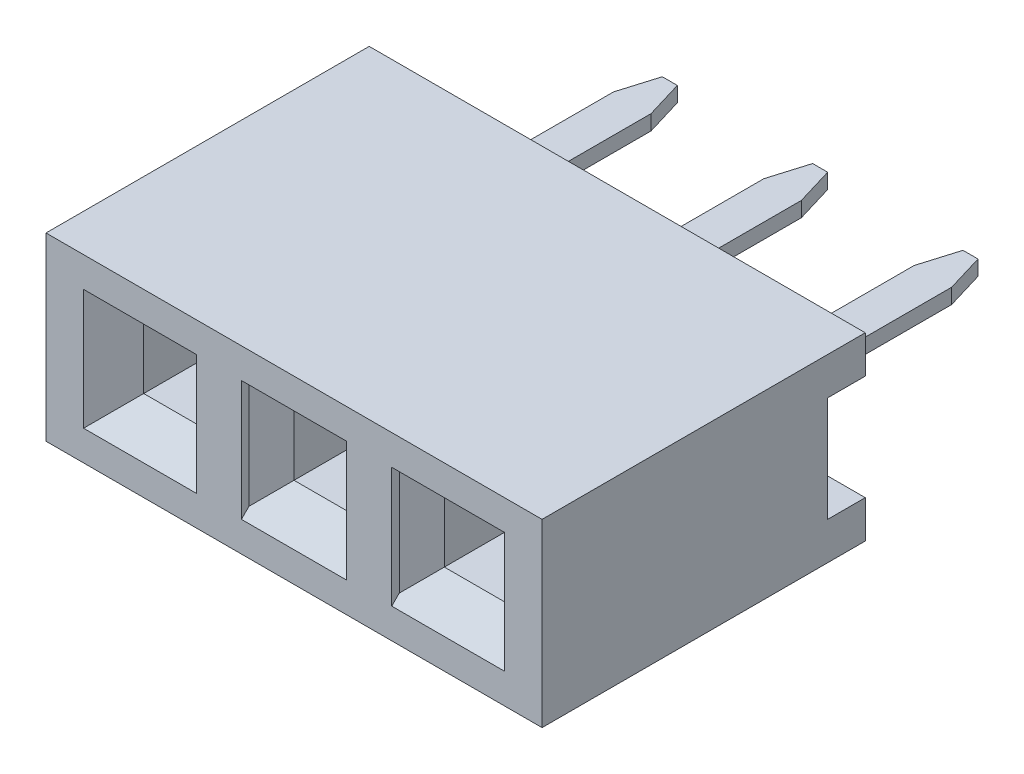
from build123d import *

# Parameters (mm, degrees)
SKETCH1_W           = 2.4
SKETCH1_H           = 4.3
BOSS_EXTRUDE1_DEPTH = 1.3
SKETCH_1_W          = 0.5
SKETCH_1_H          = 1.4
CUT_EXTRUDE_1_DEPTH = 6.166236541
SKETCH2_W           = 0.8
SKETCH2_H           = 0.8
CUT_EXTRUDE1_DEPTH  = 3.1
CHAMFER_1_SIZE      = 0.4
BOSS_EXTRUDE2_DEPTH = 0.1
LPATTERN1_COUNT     = 3
LPATTERN1_PITCH     = 2


with BuildPart() as part:
    # Sketch1 → Boss-Extrude1 (new, symmetric)
    with BuildSketch(Plane(origin=(0, 0, 0), x_dir=(0, -1, 0), z_dir=(1, 0, 0))):
        with Locations((0, -2.15)):
            Rectangle(SKETCH1_W, SKETCH1_H)
    extrude(amount=BOSS_EXTRUDE1_DEPTH, both=True)

    # Эскиз1 → Вырез-Вытянуть1 (cut, through all)
    with BuildSketch(Plane(origin=(1.3, 0, 0), x_dir=(0, 0, -1), z_dir=(1, 0, 0))):
        with Locations((-0.25, 0)):
            Rectangle(SKETCH_1_W, SKETCH_1_H)
    extrude(amount=-CUT_EXTRUDE_1_DEPTH, mode=Mode.SUBTRACT)

    # Sketch2 → Cut-Extrude1 (cut)
    with BuildSketch(Plane(origin=(0, 0, 4.3), x_dir=(-1, 0, 0), z_dir=(0, 0, 1))):
        Rectangle(SKETCH2_W, SKETCH2_H)
    extrude(amount=-CUT_EXTRUDE1_DEPTH, mode=Mode.SUBTRACT)

    # Фаска1
    chamfer_1_edges = [part.edges().sort_by_distance(p)[0] for p in [
        (-0.4, 0, 4.3),
        (0, -0.4, 4.3),
        (0.4, 0, 4.3),
        (0, 0.4, 4.3),
    ]]
    chamfer(chamfer_1_edges, length=CHAMFER_1_SIZE)

    # Sketch3 → Boss-Extrude2 (add, symmetric)
    with BuildSketch(Plane(origin=(0, 0, 0), x_dir=(1, 0, 0), z_dir=(0, 1, 0))):
        Polygon((-0.25, 0), (-0.25, 2.2), (-0.1, 2.7), (0.1, 2.7), (0.25, 2.2), (0.25, 0), (0.25, -0.5), (-0.25, -0.5), align=None)
        Polygon((0.4, -1.2), (-0.4, -1.2), (-0.4, -3.1), (-0.3, -3.1), (-0.3, -1.3), (0.3, -1.3), (0.3, -3.1), (0.4, -3.1), align=None)
    extrude(amount=BOSS_EXTRUDE2_DEPTH, both=True)


with BuildPart() as lpattern1_1:
    # LPattern1: pattern copy
    add(part.part.moved(Location(Vector(1, 0, 0) * (1 * LPATTERN1_PITCH))))


with BuildPart() as lpattern1_2:
    # LPattern1: pattern copy
    add(part.part.moved(Location(Vector(1, 0, 0) * (2 * LPATTERN1_PITCH))))


with BuildPart() as lpattern1_1_1:
    add(lpattern1_1.part)

    # Combine 1: union part, LPattern1_2
    add(part.part)
    add(lpattern1_2.part)


solid = lpattern1_1_1.part
